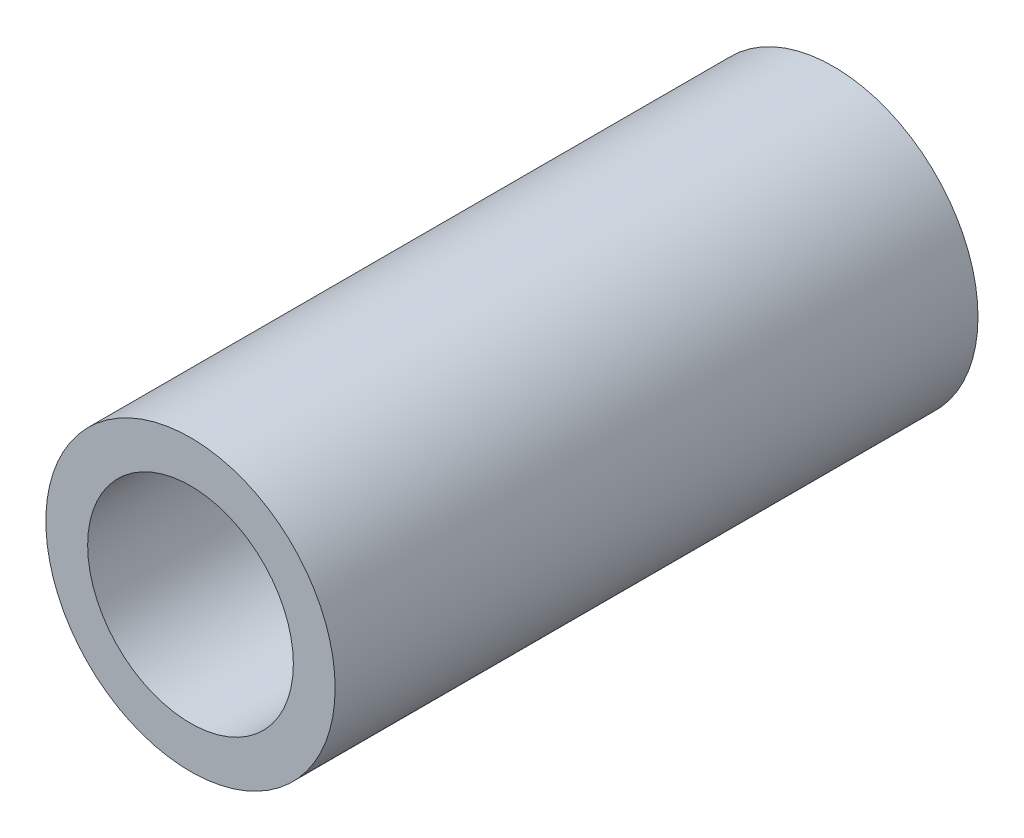
from build123d import *

# Parameters (mm, degrees)
SKETCH1_R      = 2.25
SKETCH1_R_2    = 1.6
EXTRUDE1_DEPTH = 5


with BuildPart() as part:
    # Sketch1 → Extrude1 (new, symmetric)
    with BuildSketch(Plane.XY):
        Circle(SKETCH1_R)
        Circle(SKETCH1_R_2, mode=Mode.SUBTRACT)
    extrude(amount=EXTRUDE1_DEPTH, both=True)


solid = part.part
